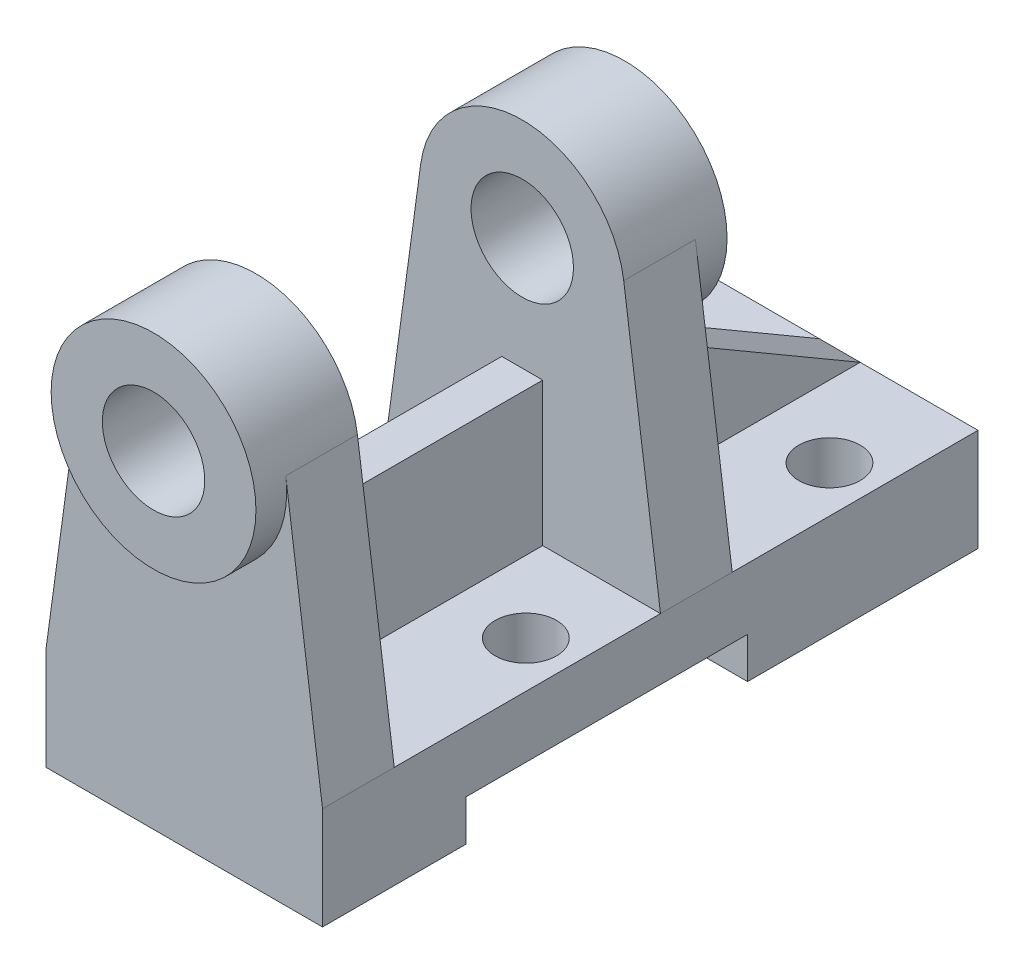
from build123d import *

# Parameters (mm, degrees)
BOSS_EXTRUDE1_DEPTH      = 27
BOSS_EXTRUDE2_DEPTH      = 6
BOSS_EXTRUDE2_DEPTH_BACK = 14
SKETCH2_R                = 20
BOSS_EXTRUDE3_START      = -6
BOSS_EXTRUDE3_DEPTH      = 14
BOSS_EXTRUDE4_START      = -14
BOSS_EXTRUDE4_DEPTH      = 14
BOSS_EXTRUDE5_START      = -20
SKETCH5_R                = 20
BOSS_EXTRUDE5_DEPTH      = 20
HOLE1_D                  = 20
SKETCH8_W                = 52
SKETCH8_H                = 28
BOSS_EXTRUDE6_DEPTH      = 4
BOSS_EXTRUDE7_DEPTH      = 4
HOLE2_D                  = 12
LPATTERN1_COUNT          = 2
LPATTERN1_PITCH          = 59.3


with BuildPart() as part:
    # Sketch1 → Boss-Extrude1 (new, symmetric)
    with BuildSketch(Plane(origin=(0, 0, 0), x_dir=(0, 0, -1), z_dir=(1, 0, 0))):
        Polygon((0, 0), (0, 20), (128, 20), (128, 0), (83, 0), (83, 8), (28, 8), (28, 0), align=None)
    extrude(amount=BOSS_EXTRUDE1_DEPTH, both=True)



with BuildPart() as body_2:
    # Sketch2 → Boss-Extrude2 (new, two sides: drawn at the far end of the back side and taken through both)
    with BuildSketch(Plane.XY.offset(-BOSS_EXTRUDE2_DEPTH_BACK)):
        with Locations((0, 70)):
            Circle(SKETCH2_R)
    extrude(amount=BOSS_EXTRUDE2_DEPTH + BOSS_EXTRUDE2_DEPTH_BACK)


with BuildPart() as part_1:
    add(part.part)

    add(body_2.part)  # Boss-Extrude3 merges body 2
    # Sketch3 → Boss-Extrude3 (add)
    with BuildSketch(Plane.XY.offset(6).offset(BOSS_EXTRUDE3_START)):
        with BuildLine():
            Line((27, 20), (-27, 20))
            Line((-27, 20), (-19.816768222, 72.70105484))
            ThreePointArc((-19.816768222, 72.70105484), (0, 50), (19.816768222, 72.70105484))
            Line((19.816768222, 72.70105484), (27, 20))
        make_face()
    extrude(amount=-BOSS_EXTRUDE3_DEPTH)

    # Sketch4 → Boss-Extrude4 (add)
    with BuildSketch(Plane.XY.offset(-66).offset(BOSS_EXTRUDE4_START)):
        with BuildLine():
            Line((-27, 20), (27, 20))
            Line((27, 20), (19.816768222, 72.70105484))
            ThreePointArc((19.816768222, 72.70105484), (0, 90), (-19.816768222, 72.70105484))
            Line((-19.816768222, 72.70105484), (-27, 20))
        make_face()
    extrude(amount=BOSS_EXTRUDE4_DEPTH)

    # Sketch5 → Boss-Extrude5 (add)
    with BuildSketch(Plane.XY.offset(-66).offset(BOSS_EXTRUDE5_START)):
        with Locations((0, 70)):
            Circle(SKETCH5_R)
    extrude(amount=BOSS_EXTRUDE5_DEPTH)

    # Hole1 (through all)
    with Locations(Plane.XY.offset(6)):
        with Locations((0, 70)):
            Hole(HOLE1_D / 2)

    # Sketch8 → Boss-Extrude6 (add, symmetric)
    with BuildSketch(Plane(origin=(0, 0, 0), x_dir=(0, 0, -1), z_dir=(1, 0, 0))):
        with Locations((40, 34)):
            Rectangle(SKETCH8_W, SKETCH8_H)
    extrude(amount=BOSS_EXTRUDE6_DEPTH, both=True)

    # Sketch9 → Boss-Extrude7 (add, symmetric)
    with BuildSketch(Plane(origin=(0, 0, 0), x_dir=(0, 0, -1), z_dir=(1, 0, 0))):
        Polygon((80, 48), (128, 20), (80, 20), align=None)
    extrude(amount=BOSS_EXTRUDE7_DEPTH, both=True)

    # Hole2 (through all)
    with Locations(Plane(origin=(0, 20, 0), x_dir=(1, 0, 0), z_dir=(0, 1, 0))):
        with Locations((18, 108), (-18, 108)):
            hole2 = Hole(HOLE2_D / 2)

    # LPattern1: Hole2 ×2
    with Locations(*[(0, 0, i * LPATTERN1_PITCH) for i in range(1, LPATTERN1_COUNT)]):
        add(hole2, mode=Mode.SUBTRACT)


solid = part_1.part
